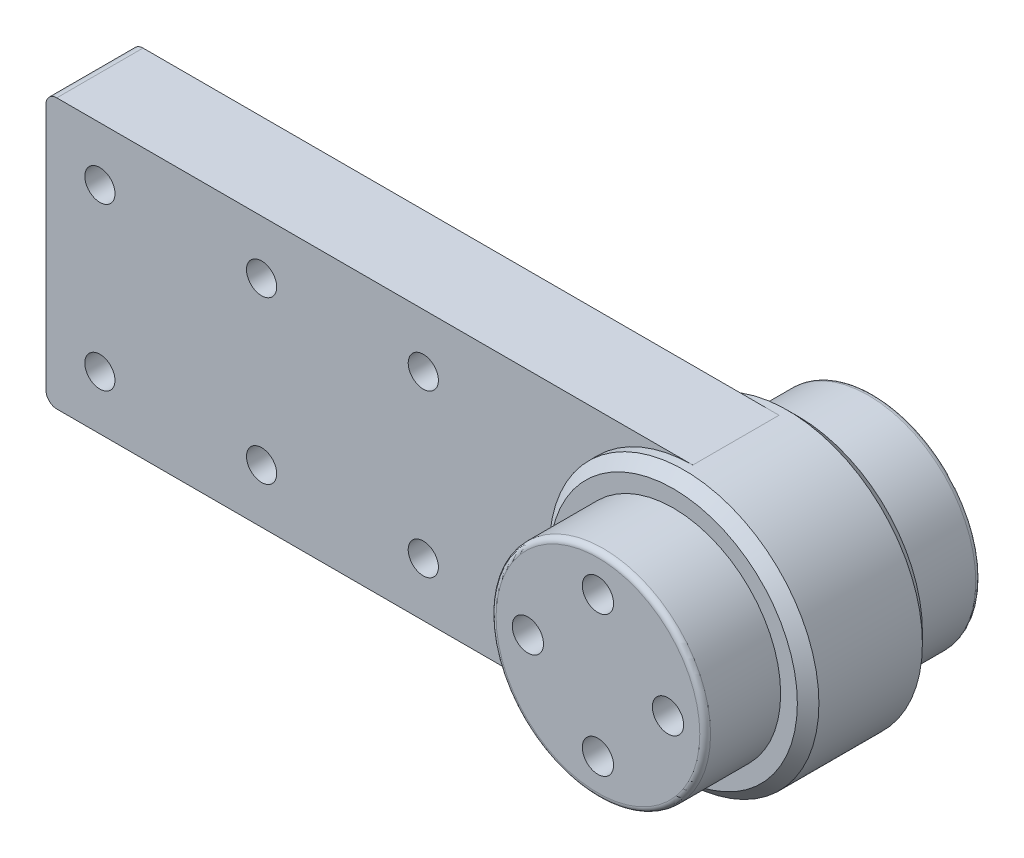
from build123d import *

# Parameters (mm, degrees)
BOSS_EXTRUDE1_DEPTH = 4
SKETCH6_R           = 1.45
CUT_EXTRUDE1_DEPTH  = 63.610622102
SKETCH7_R           = 1.4
CUT_EXTRUDE2_DEPTH  = 64.549114864
FILLET1_R           = 1
FILLET2_R           = 0.5


with BuildPart() as part:
    # Sketch4 → Revolve1 (revolve)
    with BuildSketch(Plane(origin=(0, 0, 0), x_dir=(1, 0, 0), z_dir=(0, 1, 0)), mode=Mode.PRIVATE) as revolve1_sk:
        Polygon((9.95, -8.8), (0, -8.8), (0, 0), (12.5, 0), (12.5, -0.8), (11.5, -1.8), (9.95, -1.8), align=None)
    revolve1 = revolve(revolve1_sk.sketch.rotate(Axis((0, 0, 0), (0, 0, 1)), 180), axis=Axis((0, 0, 0), (0, 0, 1)))

    # Sketch5 → Boss-Extrude1 (add)
    with BuildSketch(Plane.XY):
        with BuildLine():
            Line((0, 12.5), (-60, 12.5))
            Line((-60, 12.5), (-60, -12.5))
            Line((-60, -12.5), (0, -12.5))
            ThreePointArc((0, -12.5), (12.5, 0), (0, 12.5))
        make_face()
    boss_extrude1 = extrude(amount=-BOSS_EXTRUDE1_DEPTH)

    # Sketch6 → Cut-Extrude1 (cut, through all)
    with BuildSketch(Plane.XY.offset(8.8)):
        with Locations((0, 6.5)):
            Circle(SKETCH6_R)
        with Locations((6.5, 0)):
            Circle(SKETCH6_R)
        with Locations((0, -6.5)):
            Circle(SKETCH6_R)
        with Locations((-6.5, 0)):
            Circle(SKETCH6_R)
    cut_extrude1 = extrude(amount=-CUT_EXTRUDE1_DEPTH, mode=Mode.SUBTRACT)

    # Mirror1: Revolve1, Boss-Extrude1, Cut-Extrude1 across plane
    add(revolve1.mirror(Plane.XY.offset(-4)))
    add(boss_extrude1.mirror(Plane.XY.offset(-4)))
    add(cut_extrude1.mirror(Plane.XY.offset(-4)), mode=Mode.SUBTRACT)

    # Sketch7 → Cut-Extrude2 (cut, through all)
    with BuildSketch(Plane.XY):
        with Locations((-55, 7.5)):
            Circle(SKETCH7_R)
        with Locations((-55, -7.5)):
            Circle(SKETCH7_R)
        with Locations((-40, 7.5)):
            Circle(SKETCH7_R)
        with Locations((-40, -7.5)):
            Circle(SKETCH7_R)
        with Locations((-25, 7.5)):
            Circle(SKETCH7_R)
        with Locations((-25, -7.5)):
            Circle(SKETCH7_R)
    extrude(amount=-CUT_EXTRUDE2_DEPTH, mode=Mode.SUBTRACT)

    # Fillet1
    fillet1_edges = [part.edges().sort_by_distance(p)[0] for p in [
        (-60, -12.5, -2),
        (-60, 12.5, -2),
    ]]
    fillet(fillet1_edges, radius=FILLET1_R)

    # Fillet2
    fillet2_edges = [part.edges().sort_by_distance(p)[0] for p in [
        (9.95, 0, -16.8),
        (9.95, 0, 8.8),
    ]]
    fillet(fillet2_edges, radius=FILLET2_R)


solid = part.part
